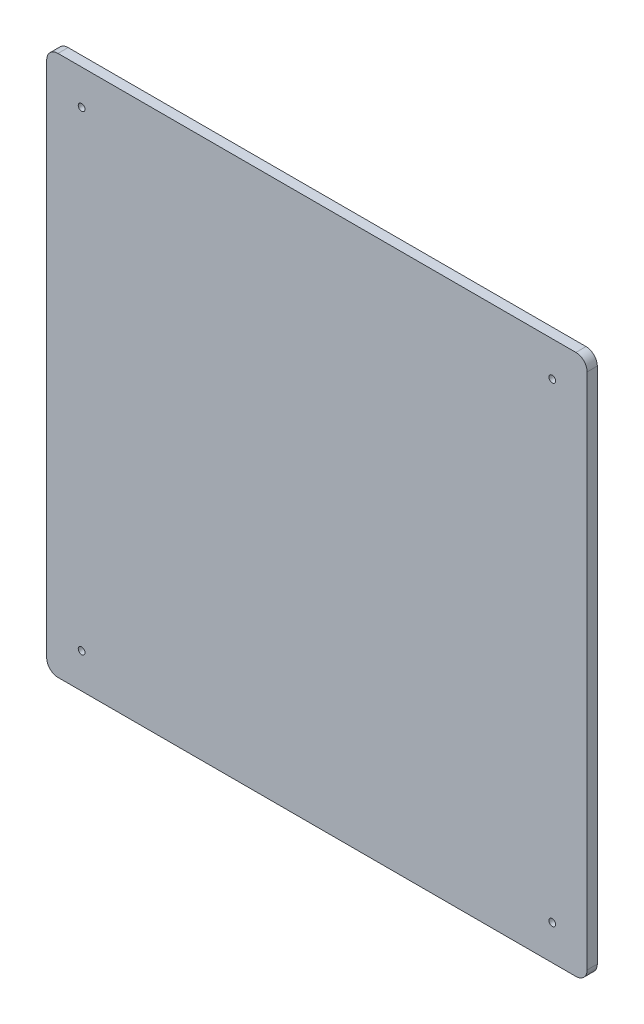
from build123d import *

# Parameters (mm, degrees)
SZKIC1_W                    = 240
SZKIC1_H                    = 240
DODANIE_WYCI_GNI_CIE1_DEPTH = 4.5
WYTNIJ_WYCI_GNI_CIE1_REACH  = 171.765
SZKIC2_R                    = 1.5
ZAOKR_GLENIE1_R             = 5


with BuildPart() as part:
    # Szkic1 → Dodanie-wyciągnięcie1 (new body)
    with BuildSketch(Plane.XY):
        Rectangle(SZKIC1_W, SZKIC1_H)
    extrude(amount=DODANIE_WYCI_GNI_CIE1_DEPTH)

    # Szkic2 → Wytnij-wyciągnięcie1 (cut, up to next)
    with BuildSketch(Plane(origin=(0, 0, 0), x_dir=(-1, 0, 0), z_dir=(0, 0, -1)), mode=Mode.PRIVATE) as wytnij_wyci_gni_cie1_sk1:
        with Locations((-104.5, 104.5)):
            Circle(SZKIC2_R)
    wytnij_wyci_gni_cie1_tool1 = extrude(wytnij_wyci_gni_cie1_sk1.sketch, amount=-WYTNIJ_WYCI_GNI_CIE1_REACH, mode=Mode.PRIVATE) & part.part
    # Szkic2 → Wytnij-wyciągnięcie1 (cut, up to next)
    with BuildSketch(Plane(origin=(0, 0, 0), x_dir=(-1, 0, 0), z_dir=(0, 0, -1)), mode=Mode.PRIVATE) as wytnij_wyci_gni_cie1_sk2:
        with Locations((104.5, 104.5)):
            Circle(SZKIC2_R)
    wytnij_wyci_gni_cie1_tool2 = extrude(wytnij_wyci_gni_cie1_sk2.sketch, amount=-WYTNIJ_WYCI_GNI_CIE1_REACH, mode=Mode.PRIVATE) & part.part
    # Szkic2 → Wytnij-wyciągnięcie1 (cut, up to next)
    with BuildSketch(Plane(origin=(0, 0, 0), x_dir=(-1, 0, 0), z_dir=(0, 0, -1)), mode=Mode.PRIVATE) as wytnij_wyci_gni_cie1_sk3:
        with Locations((-104.5, -104.5)):
            Circle(SZKIC2_R)
    wytnij_wyci_gni_cie1_tool3 = extrude(wytnij_wyci_gni_cie1_sk3.sketch, amount=-WYTNIJ_WYCI_GNI_CIE1_REACH, mode=Mode.PRIVATE) & part.part
    # Szkic2 → Wytnij-wyciągnięcie1 (cut, up to next)
    with BuildSketch(Plane(origin=(0, 0, 0), x_dir=(-1, 0, 0), z_dir=(0, 0, -1)), mode=Mode.PRIVATE) as wytnij_wyci_gni_cie1_sk4:
        with Locations((104.5, -104.5)):
            Circle(SZKIC2_R)
    wytnij_wyci_gni_cie1_tool4 = extrude(wytnij_wyci_gni_cie1_sk4.sketch, amount=-WYTNIJ_WYCI_GNI_CIE1_REACH, mode=Mode.PRIVATE) & part.part
    add(wytnij_wyci_gni_cie1_tool1.solids().sort_by_distance((104.5, 104.5, 0))[0], mode=Mode.SUBTRACT)
    add(wytnij_wyci_gni_cie1_tool2.solids().sort_by_distance((-104.5, 104.5, 0))[0], mode=Mode.SUBTRACT)
    add(wytnij_wyci_gni_cie1_tool3.solids().sort_by_distance((104.5, -104.5, 0))[0], mode=Mode.SUBTRACT)
    add(wytnij_wyci_gni_cie1_tool4.solids().sort_by_distance((-104.5, -104.5, 0))[0], mode=Mode.SUBTRACT)

    # Zaokrąglenie1
    zaokr_glenie1_edges = [part.edges().sort_by_distance(p)[0] for p in [
        (120, -120, 2.25),
        (-120, -120, 2.25),
        (-120, 120, 2.25),
        (120, 120, 2.25),
    ]]
    fillet(zaokr_glenie1_edges, radius=ZAOKR_GLENIE1_R)


solid = part.part
